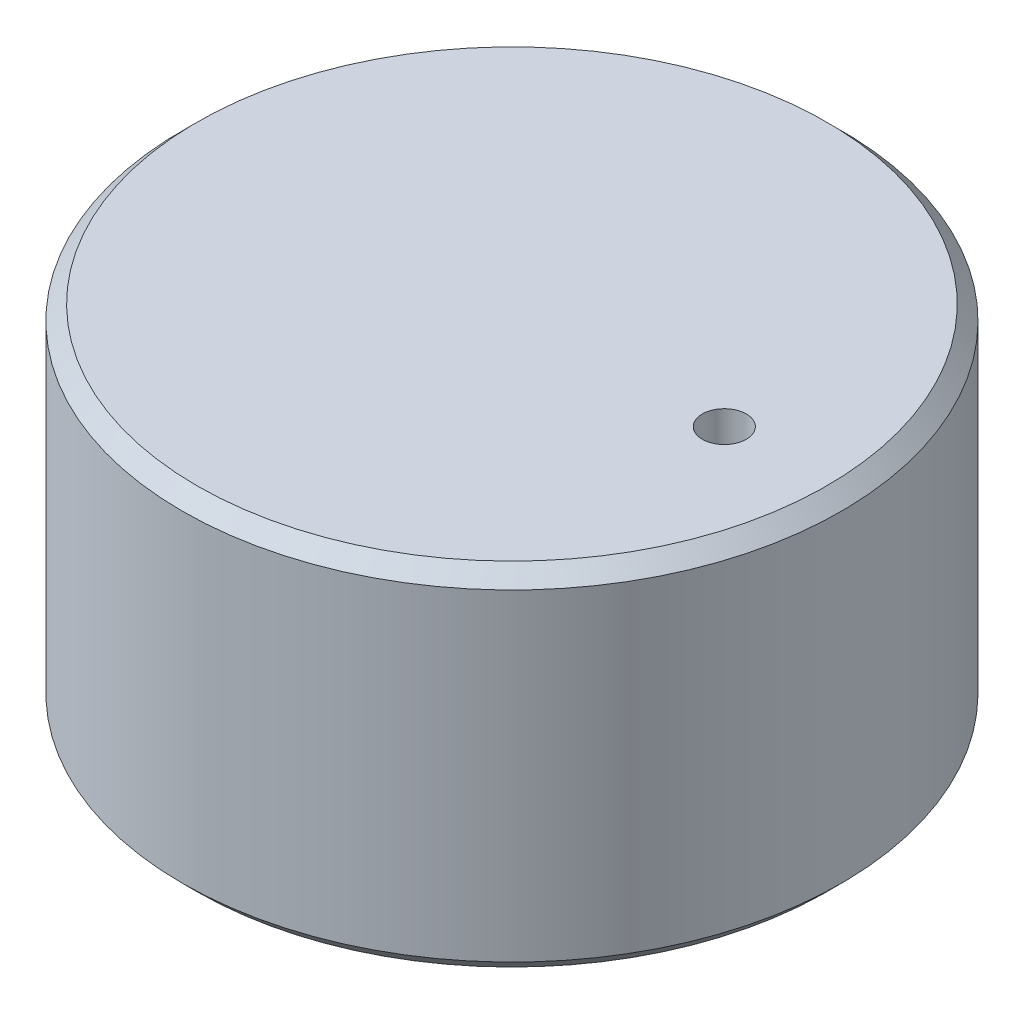
from build123d import *

# Parameters (mm, degrees)
SKETCH1_R           = 22.5
BOSS_EXTRUDE1_DEPTH = 24
CHAMFER1_SIZE       = 1
SKETCH2_R           = 1.5
CUT_EXTRUDE1_DEPTH  = 40.855990767


with BuildPart() as part:
    # Sketch1 → Boss-Extrude1 (new body)
    with BuildSketch(Plane(origin=(0, 0, 0), x_dir=(1, 0, 0), z_dir=(0, 1, 0))):
        with Locations(Location((0, 0, 0), (0, 0, 270))):
            Circle(SKETCH1_R)
    extrude(amount=BOSS_EXTRUDE1_DEPTH)

    # Chamfer1
    chamfer1_edges = [part.edges().sort_by_distance(p)[0] for p in [
        (0, 0, -22.5),
        (0, 24, -22.5),
    ]]
    chamfer(chamfer1_edges, length=CHAMFER1_SIZE)

    # Sketch2 → Cut-Extrude1 (cut, through all)
    with BuildSketch(Plane(origin=(0, 24, 0), x_dir=(1, 0, 0), z_dir=(0, 1, 0))):
        with Locations(Location((14.5, 0, 0), (0, 0, 270))):
            Circle(SKETCH2_R)
    extrude(amount=-CUT_EXTRUDE1_DEPTH, mode=Mode.SUBTRACT)


solid = part.part
